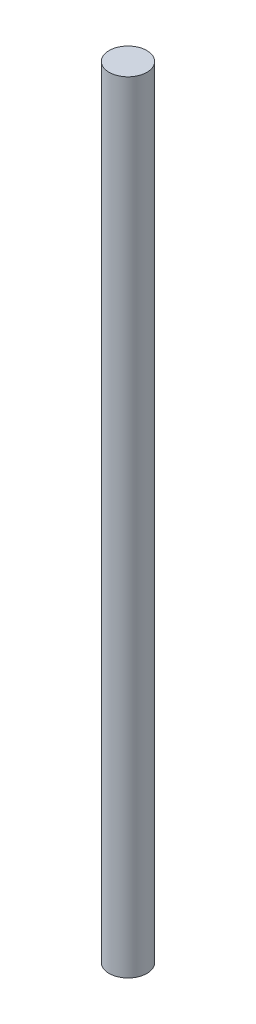
from build123d import *

# Parameters (mm, degrees)
SKETCH_1_R      = 15
EXTRUDE_1_DEPTH = 310


with BuildPart() as part:
    # 草图1 → 凸台-拉伸1 (new, symmetric)
    with BuildSketch(Plane(origin=(0, 0, 0), x_dir=(1, 0, 0), z_dir=(0, 1, 0))):
        with Locations(Location((0, 0, 0), (0, 0, 270))):
            Circle(SKETCH_1_R)
    extrude(amount=EXTRUDE_1_DEPTH, both=True)


solid = part.part
